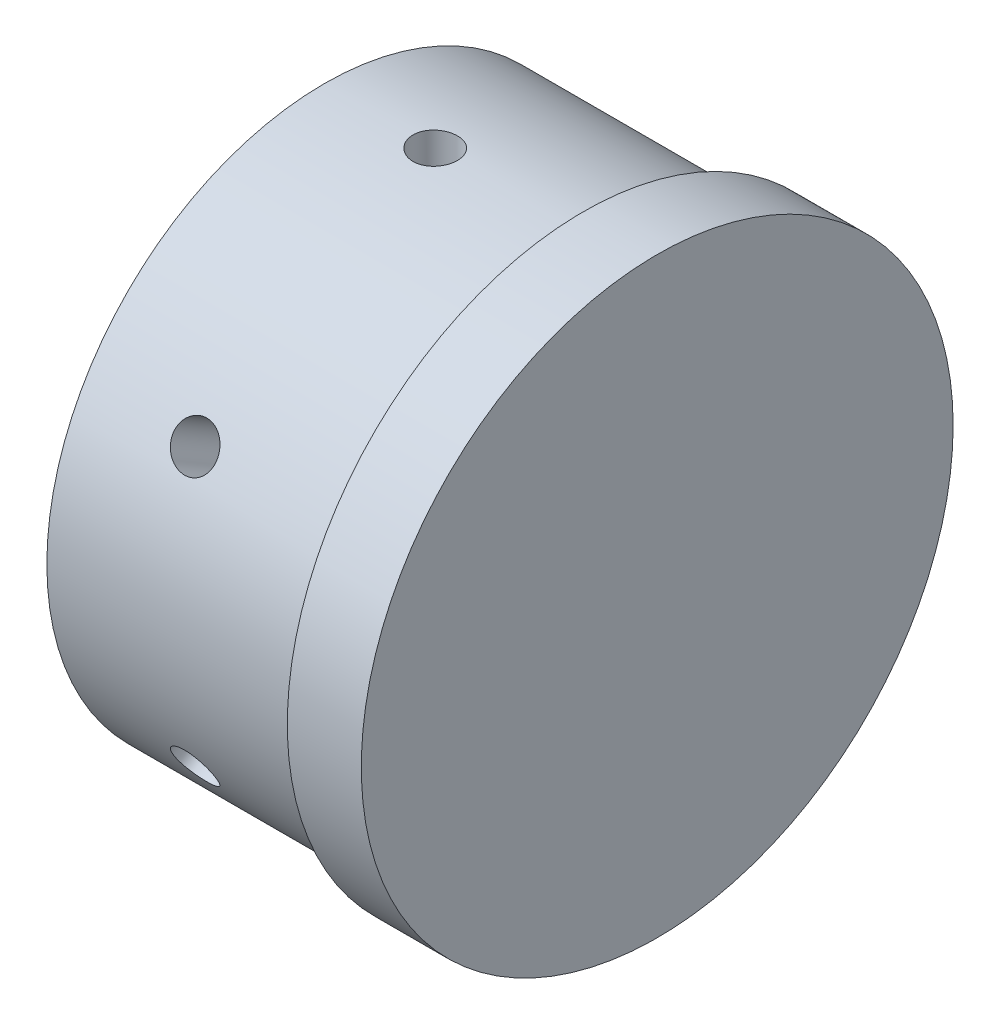
from build123d import *

# Parameters (mm, degrees)
SKETCH1_R           = 37.5
BOSS_EXTRUDE1_DEPTH = 35
SKETCH2_R           = 40
BOSS_EXTRUDE2_DEPTH = 10
SKETCH3_R           = 3
CUT_EXTRUDE1_DEPTH  = 10
CIRPATTERN1_COUNT   = 6


with BuildPart() as part:
    # Sketch1 → Boss-Extrude1 (new body)
    with BuildSketch(Plane(origin=(0, 0, 0), x_dir=(0, 0, -1), z_dir=(1, 0, 0))):
        Circle(SKETCH1_R)
    extrude(amount=BOSS_EXTRUDE1_DEPTH)

    # Sketch2 → Boss-Extrude2 (add)
    with BuildSketch(Plane(origin=(35, 0, 0), x_dir=(0, 0, -1), z_dir=(1, 0, 0))):
        Circle(SKETCH2_R)
    extrude(amount=BOSS_EXTRUDE2_DEPTH)

    # Sketch3 → Cut-Extrude1 (cut)
    with BuildSketch(Plane(origin=(0, 37.5, 0), x_dir=(1, 0, 0), z_dir=(0, 1, 0))):
        with Locations(Location((15, 0, 0), (0, 0, 270))):
            Circle(SKETCH3_R)
    cut_extrude1 = extrude(amount=-CUT_EXTRUDE1_DEPTH, mode=Mode.SUBTRACT)

    # CirPattern1: Cut-Extrude1 ×6 about axis
    cirpattern1_axis = Axis((0, 0, 0), (1, 0, 0))
    for i in range(1, CIRPATTERN1_COUNT):
        add(cut_extrude1.rotate(cirpattern1_axis, i * 360 / CIRPATTERN1_COUNT), mode=Mode.SUBTRACT)


solid = part.part
